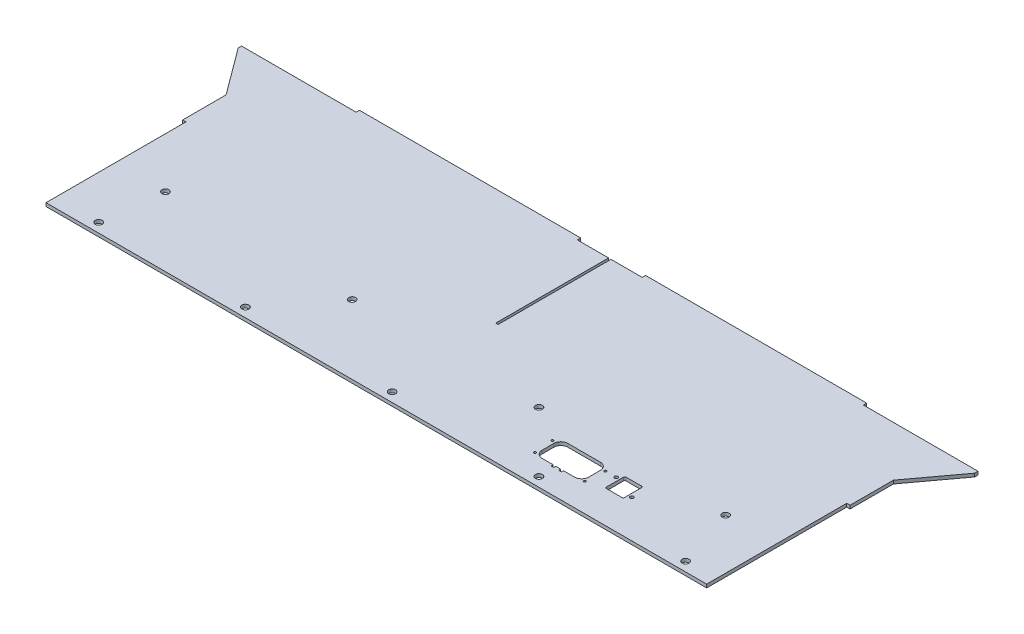
from build123d import *

# Parameters (mm, degrees)
SKETCH1_W            = 635.3556
SKETCH1_H            = 222.25
BOSS_EXTRUDE1_DEPTH  = 1.5875
BOSS_EXTRUDE3_DEPTH  = 3.175
CUT_EXTRUDE1_DEPTH   = 10
LPATTERN1_COUNT      = 5
LPATTERN1_PITCH      = 139.7
SKETCH6_W            = 3.175
SKETCH6_H            = 133.35
SKETCH6_W_2          = 2.286
SKETCH6_H_2          = 107.442
CUT_EXTRUDE2_DEPTH   = 368.782646164
M6_CLEARANCE_HOLE1_D = 6.6
LPATTERN2_COUNT      = 4
LPATTERN2_PITCH      = 177.8
SKETCH12_W           = 210.6549
SKETCH12_H           = 3.175
BOSS_EXTRUDE4_DEPTH  = 3.175
CUT_EXTRUDE3_DEPTH   = 369.754388712


with BuildPart() as part:
    # Sketch1 → Boss-Extrude1 (new, symmetric)
    with BuildSketch(Plane(origin=(0, 0, 0), x_dir=(1, 0, 0), z_dir=(0, 1, 0))):
        Rectangle(SKETCH1_W, SKETCH1_H)
    extrude(amount=BOSS_EXTRUDE1_DEPTH, both=True)

    # Sketch3 → Boss-Extrude3 (add)
    with BuildSketch(Plane(origin=(0, 1.5875, 0), x_dir=(1, 0, 0), z_dir=(0, 1, 0))):
        Polygon((-317.6778, 63.5), (-317.6778, 111.125), (-350.57842, 111.125), (-350.57842, 107.95), align=None)
    boss_extrude3 = extrude(amount=-BOSS_EXTRUDE3_DEPTH)

    # Mirror1: Boss-Extrude3 across plane
    add(boss_extrude3.mirror(Plane(origin=(0, 0, 0), x_dir=(0, 0, 1), z_dir=(1, 0, 0))))

    # Sketch4 → Cut-Extrude1 (cut)
    with BuildSketch(Plane(origin=(0, 1.5875, 0), x_dir=(1, 0, 0), z_dir=(0, 1, 0))):
        with BuildLine():
            ThreePointArc((-276.5298, -102.235), (-275.562666591, -104.569866591), (-273.2278, -105.537))
            Line((-273.2278, -105.537), (-273.2278, -102.235))
            Line((-273.2278, -102.235), (-276.5298, -102.235))
        make_face()
        with BuildLine():
            Line((-273.2278, -102.235), (-273.2278, -105.537))
            ThreePointArc((-273.2278, -105.537), (-270.892933409, -104.569866591), (-269.9258, -102.235))
            ThreePointArc((-269.9258, -102.235), (-273.2278, -98.933), (-276.5298, -102.235))
            Line((-276.5298, -102.235), (-273.2278, -102.235))
        make_face()
    cut_extrude1 = extrude(amount=-CUT_EXTRUDE1_DEPTH, mode=Mode.SUBTRACT)

    # LPattern1: Cut-Extrude1 ×5
    with Locations(*[(i * LPATTERN1_PITCH, 0, 0) for i in range(1, LPATTERN1_COUNT)]):
        add(cut_extrude1, mode=Mode.SUBTRACT)

    # Sketch6 → Cut-Extrude2 (cut, through all)
    with BuildSketch(Plane(origin=(0, 1.5875, 0), x_dir=(1, 0, 0), z_dir=(0, 1, 0))):
        with Locations((316.0903, -44.45)):
            Rectangle(SKETCH6_W, SKETCH6_H)
        with Locations((-316.0903, -44.45)):
            Rectangle(SKETCH6_W, SKETCH6_H)
        with Locations((0, 57.404)):
            Rectangle(SKETCH6_W_2, SKETCH6_H_2)
    extrude(amount=-CUT_EXTRUDE2_DEPTH, mode=Mode.SUBTRACT)

    # M6 Clearance Hole1 (through all)
    with Locations(Plane(origin=(0, 1.5875, 0), x_dir=(1, 0, 0), z_dir=(0, 1, 0))):
        with Locations((266.7, -45.2374)):
            m6_clearance_hole1 = Hole(M6_CLEARANCE_HOLE1_D / 2)

    # LPattern2: M6 Clearance Hole1 ×4
    with Locations(*[(-i * LPATTERN2_PITCH, 0, 0) for i in range(1, LPATTERN2_COUNT)]):
        add(m6_clearance_hole1, mode=Mode.SUBTRACT)

    # Sketch12 → Boss-Extrude4 (add)
    with BuildSketch(Plane(origin=(0, 0, -111.125), x_dir=(-1, 0, 0), z_dir=(0, 0, -1))):
        with Locations((-136.15035, 0)):
            Rectangle(SKETCH12_W, SKETCH12_H)
        with Locations((136.15035, 0)):
            Rectangle(SKETCH12_W, SKETCH12_H)
    extrude(amount=BOSS_EXTRUDE4_DEPTH)

    # Sketch13 → Cut-Extrude3 (cut, through all)
    with BuildSketch(Plane(origin=(0, 1.5875, 0), x_dir=(1, 0, 0), z_dir=(0, 1, 0))):
        with BuildLine():
            add(Edge.make_bspline(
                [(187.864233968, -80.025396339), (189.329368232, -80.025396339), (191.127179802, -77.455295235), (195.339233968, -79.347764363)],
                knots=[1, 1, 1, 1, 3.549888024, 3.549888024, 3.549888024, 3.549888024], degree=3))
            Line((187.864233968, -80.025396339), (194.052572976, -80.025396339))
            add(Edge.make_bspline(
                [(194.052572976, -80.025396339), (194.505115843, -79.75389316), (194.93338213, -79.530112938), (195.339233968, -79.347764363)],
                knots=[-2.795582096, -2.795582096, -2.795582096, -2.795582096, -2.549888024, -2.549888024, -2.549888024, -2.549888024], degree=3))
        make_face()
        with BuildLine():
            add(Edge.make_bspline(
                [(172.699220274, -84.2845266), (172.696730983, -84.975084699), (172.146526339, -85.612330075), (171.260043392, -85.306178116)],
                knots=[0.001799128, 0.001799128, 0.001799128, 0.001799128, 0.583907467, 0.583907467, 0.583907467, 0.583907467], degree=3, weights=[0.996408218, 0.609732375, 0.448956611, 0.514080926]))
            add(Edge.make_bspline(
                [(172.699220274, -84.2845266), (172.233117294, -84.619527082), (171.753512925, -84.960041697), (171.260043392, -85.306178116)],
                knots=[5.458035513, 5.458035513, 5.458035513, 5.458035513, 5.553043212, 5.553043212, 5.553043212, 5.553043212], degree=3))
        make_face()
        with BuildLine():
            add(Edge.make_bspline(
                [(172.699220274, -84.2845266), (172.233117294, -84.619527082), (171.753512925, -84.960041697), (171.260043392, -85.306178116)],
                knots=[5.458035513, 5.458035513, 5.458035513, 5.458035513, 5.553043212, 5.553043212, 5.553043212, 5.553043212], degree=3))
            add(Edge.make_bspline(
                [(172.699227323, -84.280615468), (172.699227323, -84.2819184), (172.699224976, -84.283222113), (172.699220274, -84.2845266)],
                knots=[0, 0, 0, 0, 0.001799128, 0.001799128, 0.001799128, 0.001799128], degree=3, weights=[1, 0.998800581, 0.997603321, 0.996408218]))
            add(Edge.make_bspline(
                [(170.529227323, -84.280615468), (170.529227323, -82.110615468), (172.699227323, -82.110615468), (172.699227323, -84.280615468)],
                knots=[0, 0, 0, 0, 1, 1, 1, 1], degree=3, weights=[1, 0.333333333, 0.333333333, 1]))
            add(Edge.make_bspline(
                [(171.260043392, -85.306178116), (170.752605364, -85.130931488), (170.529227323, -84.697127405), (170.529227323, -84.280615468)],
                knots=[0.583907467, 0.583907467, 0.583907467, 0.583907467, 1, 1, 1, 1], degree=3, weights=[0.514080926, 0.560631953, 0.722604978, 1]))
        make_face()
        with BuildLine():
            add(Edge.make_bspline(
                [(181.739234014, -66.150396507), (181.739234014, -67.66409649), (183.22321105, -68.736498813), (184.551445026, -67.194687876)],
                knots=[0, 0, 0, 0, 0.364606415, 0.364606415, 0.364606415, 0.364606415], degree=3, weights=[1, 0.513858114, 0.382217128, 0.605077042]))
            add(Edge.make_bspline(
                [(182.357862006, -64.886707866), (183.199836269, -65.706024515), (183.9264051, -66.473982103), (184.551445026, -67.194687876)],
                knots=[-3.591687883, -3.591687883, -3.591687883, -3.591687883, -3.27186619, -3.27186619, -3.27186619, -3.27186619], degree=3))
            add(Edge.make_bspline(
                [(182.357862006, -64.886707866), (181.921014319, -65.22596081), (181.739234014, -65.701474289), (181.739234014, -66.150396507)],
                knots=[0.83567377, 0.83567377, 0.83567377, 0.83567377, 1, 1, 1, 1], degree=3, weights=[0.558719959, 0.633805013, 0.78089836, 1]))
        make_face()
        with BuildLine():
            add(Edge.make_bspline(
                [(182.357862006, -64.886707866), (183.199836269, -65.706024515), (183.9264051, -66.473982103), (184.551445026, -67.194687876)],
                knots=[-3.591687883, -3.591687883, -3.591687883, -3.591687883, -3.27186619, -3.27186619, -3.27186619, -3.27186619], degree=3))
            add(Edge.make_bspline(
                [(184.551445026, -67.194687876), (184.825523373, -66.876538362), (184.939234014, -66.502865553), (184.939234014, -66.150396507), (184.939234014, -64.854128028), (183.75318586, -63.803108847), (182.357862006, -64.886707866)],
                knots=[0.364606415, 0.364606415, 0.364606415, 0.364606415, 0.5, 0.5, 0.5, 0.83567377, 0.83567377, 0.83567377, 0.83567377], degree=3, weights=[0.605077042, 0.687834234, 0.81947522, 1, 0.552434973, 0.405341626, 0.558719959]))
        make_face()
        with BuildLine():
            add(Edge.make_bspline(
                [(208.320606163, -76.414085039), (208.757453751, -76.074832094), (208.939234014, -75.599318671), (208.939234014, -75.150396507), (208.939234014, -73.636696641), (207.455257135, -72.564294316), (206.127023101, -74.106105024)],
                knots=[0.335673786, 0.335673786, 0.335673786, 0.335673786, 0.5, 0.5, 0.5, 0.8646064, 0.8646064, 0.8646064, 0.8646064], degree=3, weights=[0.55871998, 0.633805041, 0.780898381, 1, 0.513858133, 0.382217138, 0.605077016]))
            add(Edge.make_bspline(
                [(208.320606163, -76.414085039), (207.478631887, -75.594768389), (206.752063041, -74.826810798), (206.127023101, -74.106105024)],
                knots=[-3.591687913, -3.591687913, -3.591687913, -3.591687913, -3.271866223, -3.271866223, -3.271866223, -3.271866223], degree=3))
        make_face()
        with BuildLine():
            add(Edge.make_bspline(
                [(208.320606163, -76.414085039), (207.478631887, -75.594768389), (206.752063041, -74.826810798), (206.127023101, -74.106105024)],
                knots=[-3.591687913, -3.591687913, -3.591687913, -3.591687913, -3.271866223, -3.271866223, -3.271866223, -3.271866223], degree=3))
            add(Edge.make_bspline(
                [(206.127023101, -74.106105024), (205.852944683, -74.424254558), (205.739234014, -74.797927416), (205.739234014, -75.150396507)],
                knots=[0.8646064, 0.8646064, 0.8646064, 0.8646064, 1, 1, 1, 1], degree=3, weights=[0.605077016, 0.687834206, 0.8194752, 1]))
            add(Edge.make_bspline(
                [(205.739234014, -75.150396507), (205.739234014, -76.446665096), (206.925282317, -77.497684302), (208.320606163, -76.414085039)],
                knots=[0, 0, 0, 0, 0.335673786, 0.335673786, 0.335673786, 0.335673786], degree=3, weights=[1, 0.552434953, 0.405341613, 0.55871998]))
        make_face()
        with BuildLine():
            add(Edge.make_bspline(
                [(186.714233968, -78.875396339), (186.714233968, -79.019043261), (186.763644326, -79.299941363), (187.025758436, -79.71387187), (187.439688944, -79.975985981), (187.720587046, -80.025396339), (187.864233968, -80.025396339)],
                knots=[0, 0, 0, 0, 0.25, 0.5, 0.75, 1, 1, 1, 1], degree=3))
            add(Edge.make_bspline(
                [(187.864233968, -80.025396339), (189.329368232, -80.025396339), (191.127179802, -77.455295235), (195.339233968, -79.347764363)],
                knots=[1, 1, 1, 1, 3.549888024, 3.549888024, 3.549888024, 3.549888024], degree=3))
            add(Edge.make_bspline(
                [(195.339233968, -79.347764363), (199.551288134, -77.455295235), (201.349099704, -80.025396339), (202.814233968, -80.025396339)],
                knots=[-2.549888024, -2.549888024, -2.549888024, -2.549888024, 0, 0, 0, 0], degree=3))
            add(Edge.make_bspline(
                [(202.814233968, -80.025396339), (202.95788089, -80.025396339), (203.238778991, -79.975985981), (203.652709499, -79.71387187), (203.914823609, -79.299941363), (203.964233968, -79.019043261), (203.964233968, -78.875396339)],
                knots=[0, 0, 0, 0, 0.25, 0.5, 0.75, 1, 1, 1, 1], degree=3))
            add(Edge.make_bspline(
                [(203.964233968, -78.875396339), (203.964233968, -77.326116927), (201.0904451, -75.40485046), (203.658155381, -70.650396339)],
                knots=[1, 1, 1, 1, 3.696332423, 3.696332423, 3.696332423, 3.696332423], degree=3))
            add(Edge.make_bspline(
                [(203.658155381, -70.650396339), (201.0904451, -65.895942219), (203.964233968, -63.974675752), (203.964233968, -62.425396339)],
                knots=[-2.696332423, -2.696332423, -2.696332423, -2.696332423, 0, 0, 0, 0], degree=3))
            add(Edge.make_bspline(
                [(203.964233968, -62.425396339), (203.964233968, -62.281749417), (203.914823609, -62.000851316), (203.652709499, -61.586920808), (203.238778991, -61.324806697), (202.95788089, -61.275396339), (202.814233968, -61.275396339)],
                knots=[0, 0, 0, 0, 0.25, 0.5, 0.75, 1, 1, 1, 1], degree=3))
            add(Edge.make_bspline(
                [(202.814233968, -61.275396339), (201.349099704, -61.275396339), (199.551288134, -63.845497444), (195.339233968, -61.953028316)],
                knots=[1, 1, 1, 1, 3.549888024, 3.549888024, 3.549888024, 3.549888024], degree=3))
            add(Edge.make_bspline(
                [(195.339233968, -61.953028316), (191.127179802, -63.845497444), (189.329368232, -61.275396339), (187.864233968, -61.275396339)],
                knots=[-2.549888024, -2.549888024, -2.549888024, -2.549888024, 0, 0, 0, 0], degree=3))
            add(Edge.make_bspline(
                [(187.864233968, -61.275396339), (187.720587046, -61.275396339), (187.439688944, -61.324806697), (187.025758436, -61.586920808), (186.763644326, -62.000851316), (186.714233968, -62.281749417), (186.714233968, -62.425396339)],
                knots=[0, 0, 0, 0, 0.25, 0.5, 0.75, 1, 1, 1, 1], degree=3))
            add(Edge.make_bspline(
                [(186.714233968, -62.425396339), (186.714233968, -63.974675752), (189.588022835, -65.895942219), (187.020312554, -70.650396339)],
                knots=[1, 1, 1, 1, 3.696332423, 3.696332423, 3.696332423, 3.696332423], degree=3))
            add(Edge.make_bspline(
                [(187.020312554, -70.650396339), (189.588022835, -75.40485046), (186.714233968, -77.326116927), (186.714233968, -78.875396339)],
                knots=[-2.696332423, -2.696332423, -2.696332423, -2.696332423, 0, 0, 0, 0], degree=3))
        make_face()
        with BuildLine():
            add(Edge.make_bspline(
                [(194.052572976, -80.025396339), (194.505115843, -79.75389316), (194.93338213, -79.530112938), (195.339233968, -79.347764363)],
                knots=[-2.795582096, -2.795582096, -2.795582096, -2.795582096, -2.549888024, -2.549888024, -2.549888024, -2.549888024], degree=3))
            Line((194.052572976, -80.025396339), (196.625894959, -80.025396339))
            add(Edge.make_bspline(
                [(195.339233968, -79.347764363), (195.745085806, -79.530112938), (196.173352092, -79.75389316), (196.625894959, -80.025396339)],
                knots=[3.549888024, 3.549888024, 3.549888024, 3.549888024, 3.795582096, 3.795582096, 3.795582096, 3.795582096], degree=3))
        make_face()
        with BuildLine():
            Line((186.714233968, -71.187057331), (186.714233968, -78.875396339))
            add(Edge.make_bspline(
                [(187.020312554, -70.650396339), (189.588022835, -75.40485046), (186.714233968, -77.326116927), (186.714233968, -78.875396339)],
                knots=[-2.696332423, -2.696332423, -2.696332423, -2.696332423, 0, 0, 0, 0], degree=3))
            add(Edge.make_bspline(
                [(187.020312554, -70.650396339), (186.925797352, -70.825403699), (186.823909393, -71.00424978), (186.714233968, -71.187057331)],
                knots=[3.696332423, 3.696332423, 3.696332423, 3.696332423, 3.795582096, 3.795582096, 3.795582096, 3.795582096], degree=3))
        make_face()
        with BuildLine():
            add(Edge.make_bspline(
                [(195.339233968, -79.347764363), (199.551288134, -77.455295235), (201.349099704, -80.025396339), (202.814233968, -80.025396339)],
                knots=[-2.549888024, -2.549888024, -2.549888024, -2.549888024, 0, 0, 0, 0], degree=3))
            add(Edge.make_bspline(
                [(195.339233968, -79.347764363), (195.745085806, -79.530112938), (196.173352092, -79.75389316), (196.625894959, -80.025396339)],
                knots=[3.549888024, 3.549888024, 3.549888024, 3.549888024, 3.795582096, 3.795582096, 3.795582096, 3.795582096], degree=3))
            Line((196.625894959, -80.025396339), (202.814233968, -80.025396339))
        make_face()
        with BuildLine():
            Line((186.714233968, -70.113735348), (186.714233968, -71.187057331))
            add(Edge.make_bspline(
                [(187.020312554, -70.650396339), (186.925797352, -70.825403699), (186.823909393, -71.00424978), (186.714233968, -71.187057331)],
                knots=[3.696332423, 3.696332423, 3.696332423, 3.696332423, 3.795582096, 3.795582096, 3.795582096, 3.795582096], degree=3))
            add(Edge.make_bspline(
                [(186.714233968, -70.113735348), (186.823909393, -70.296542899), (186.925797352, -70.47538898), (187.020312554, -70.650396339)],
                knots=[-2.795582096, -2.795582096, -2.795582096, -2.795582096, -2.696332423, -2.696332423, -2.696332423, -2.696332423], degree=3))
        make_face()
        with BuildLine():
            add(Edge.make_bspline(
                [(186.714233968, -70.113735348), (186.823909393, -70.296542899), (186.925797352, -70.47538898), (187.020312554, -70.650396339)],
                knots=[-2.795582096, -2.795582096, -2.795582096, -2.795582096, -2.696332423, -2.696332423, -2.696332423, -2.696332423], degree=3))
            add(Edge.make_bspline(
                [(186.714233968, -62.425396339), (186.714233968, -63.974675752), (189.588022835, -65.895942219), (187.020312554, -70.650396339)],
                knots=[1, 1, 1, 1, 3.696332423, 3.696332423, 3.696332423, 3.696332423], degree=3))
            Line((186.714233968, -62.425396339), (186.714233968, -70.113735348))
        make_face()
        with BuildLine():
            add(Edge.make_bspline(
                [(203.964233968, -78.875396339), (203.964233968, -77.326116927), (201.0904451, -75.40485046), (203.658155381, -70.650396339)],
                knots=[1, 1, 1, 1, 3.696332423, 3.696332423, 3.696332423, 3.696332423], degree=3))
            Line((203.964233968, -78.875396339), (203.964233968, -71.187057331))
            add(Edge.make_bspline(
                [(203.964233968, -71.187057331), (203.854558543, -71.00424978), (203.752670584, -70.825403698), (203.658155381, -70.650396339)],
                knots=[-2.795582096, -2.795582096, -2.795582096, -2.795582096, -2.696332423, -2.696332423, -2.696332423, -2.696332423], degree=3))
        make_face()
        with BuildLine():
            Line((194.052572976, -61.275396339), (187.864233968, -61.275396339))
            add(Edge.make_bspline(
                [(195.339233968, -61.953028316), (191.127179802, -63.845497444), (189.329368232, -61.275396339), (187.864233968, -61.275396339)],
                knots=[-2.549888024, -2.549888024, -2.549888024, -2.549888024, 0, 0, 0, 0], degree=3))
            add(Edge.make_bspline(
                [(195.339233968, -61.953028316), (194.93338213, -61.770679741), (194.505115844, -61.546899518), (194.052572976, -61.275396339)],
                knots=[3.549888024, 3.549888024, 3.549888024, 3.549888024, 3.795582096, 3.795582096, 3.795582096, 3.795582096], degree=3))
        make_face()
        with BuildLine():
            add(Edge.make_bspline(
                [(203.964233968, -71.187057331), (203.854558543, -71.00424978), (203.752670584, -70.825403698), (203.658155381, -70.650396339)],
                knots=[-2.795582096, -2.795582096, -2.795582096, -2.795582096, -2.696332423, -2.696332423, -2.696332423, -2.696332423], degree=3))
            Line((203.964233968, -71.187057331), (203.964233968, -70.113735347))
            add(Edge.make_bspline(
                [(203.658155381, -70.650396339), (203.752670584, -70.47538898), (203.854558543, -70.296542898), (203.964233968, -70.113735347)],
                knots=[3.696332423, 3.696332423, 3.696332423, 3.696332423, 3.795582096, 3.795582096, 3.795582096, 3.795582096], degree=3))
        make_face()
        with BuildLine():
            add(Edge.make_bspline(
                [(203.658155381, -70.650396339), (201.0904451, -65.895942219), (203.964233968, -63.974675752), (203.964233968, -62.425396339)],
                knots=[-2.696332423, -2.696332423, -2.696332423, -2.696332423, 0, 0, 0, 0], degree=3))
            add(Edge.make_bspline(
                [(203.658155381, -70.650396339), (203.752670584, -70.47538898), (203.854558543, -70.296542898), (203.964233968, -70.113735347)],
                knots=[3.696332423, 3.696332423, 3.696332423, 3.696332423, 3.795582096, 3.795582096, 3.795582096, 3.795582096], degree=3))
            Line((203.964233968, -70.113735347), (203.964233968, -62.425396339))
        make_face()
        with BuildLine():
            Line((196.62589496, -61.275396339), (194.052572976, -61.275396339))
            add(Edge.make_bspline(
                [(195.339233968, -61.953028316), (194.93338213, -61.770679741), (194.505115844, -61.546899518), (194.052572976, -61.275396339)],
                knots=[3.549888024, 3.549888024, 3.549888024, 3.549888024, 3.795582096, 3.795582096, 3.795582096, 3.795582096], degree=3))
            add(Edge.make_bspline(
                [(196.62589496, -61.275396339), (196.173352092, -61.546899518), (195.745085806, -61.770679741), (195.339233968, -61.953028316)],
                knots=[-2.795582096, -2.795582096, -2.795582096, -2.795582096, -2.549888024, -2.549888024, -2.549888024, -2.549888024], degree=3))
        make_face()
        with BuildLine():
            add(Edge.make_bspline(
                [(196.62589496, -61.275396339), (196.173352092, -61.546899518), (195.745085806, -61.770679741), (195.339233968, -61.953028316)],
                knots=[-2.795582096, -2.795582096, -2.795582096, -2.795582096, -2.549888024, -2.549888024, -2.549888024, -2.549888024], degree=3))
            add(Edge.make_bspline(
                [(202.814233968, -61.275396339), (201.349099704, -61.275396339), (199.551288134, -63.845497444), (195.339233968, -61.953028316)],
                knots=[1, 1, 1, 1, 3.549888024, 3.549888024, 3.549888024, 3.549888024], degree=3))
            Line((202.814233968, -61.275396339), (196.62589496, -61.275396339))
        make_face()
        with BuildLine():
            Line((143.131038887, -87.780614796), (145.497415414, -87.780614796))
            Line((145.497415414, -87.780614796), (145.672392695, -85.780614626))
            Line((145.672392695, -85.780614626), (150.156061514, -85.780614626))
            Line((150.156061514, -85.780614626), (150.331038887, -87.780614796))
            Line((150.331038887, -87.780614796), (152.697415414, -87.780614796))
            Line((152.697415414, -87.780614796), (152.872392695, -85.780614626))
            Line((152.872392695, -85.780614626), (163.414227093, -85.780614626))
            ThreePointArc((163.414227093, -85.780614626), (168.151842527, -83.81823006), (170.114227093, -79.080614626))
            Line((170.114227093, -79.080614626), (170.114227093, -67.880614626))
            ThreePointArc((170.114227093, -67.880614626), (168.151842527, -63.142999192), (163.414227093, -61.180614626))
            Line((163.414227093, -61.180614626), (132.414227093, -61.180614626))
            ThreePointArc((132.414227093, -61.180614626), (127.67661166, -63.142999192), (125.714227093, -67.880614626))
            Line((125.714227093, -67.880614626), (125.714227093, -79.080614626))
            ThreePointArc((125.714227093, -79.080614626), (127.67661166, -83.81823006), (132.414227093, -85.780614626))
            Line((132.414227093, -85.780614626), (142.956061514, -85.780614626))
            Line((142.956061514, -85.780614626), (143.131038887, -87.780614796))
        make_face()
        with BuildLine():
            add(Edge.make_bspline(
                [(121.629227323, -66.180615468), (121.629227323, -64.010615468), (123.799227323, -64.010615468), (123.799227323, -66.180615468)],
                knots=[0, 0, 0, 0, 1, 1, 1, 1], degree=3, weights=[1, 0.333333333, 0.333333333, 1]))
            add(Edge.make_bspline(
                [(123.799227323, -66.180615468), (123.799227323, -68.350615468), (121.629227323, -68.350615468), (121.629227323, -66.180615468)],
                knots=[0, 0, 0, 0, 1, 1, 1, 1], degree=3, weights=[1, 0.333333333, 0.333333333, 1]))
        make_face()
        with BuildLine():
            add(Edge.make_bspline(
                [(123.129227323, -84.280615468), (123.129227323, -82.110615468), (125.299227323, -82.110615468), (125.299227323, -84.280615468)],
                knots=[0, 0, 0, 0, 1, 1, 1, 1], degree=3, weights=[1, 0.333333333, 0.333333333, 1]))
            add(Edge.make_bspline(
                [(125.299227323, -84.280615468), (125.299227323, -86.450615468), (123.129227323, -86.450615468), (123.129227323, -84.280615468)],
                knots=[0, 0, 0, 0, 1, 1, 1, 1], degree=3, weights=[1, 0.333333333, 0.333333333, 1]))
        make_face()
        with BuildLine():
            add(Edge.make_bspline(
                [(172.029227323, -66.180615468), (172.029227323, -64.010615468), (174.199227323, -64.010615468), (174.199227323, -66.180615468)],
                knots=[0, 0, 0, 0, 1, 1, 1, 1], degree=3, weights=[1, 0.333333333, 0.333333333, 1]))
            add(Edge.make_bspline(
                [(174.199227323, -66.180615468), (174.199227323, -68.350615468), (172.029227323, -68.350615468), (172.029227323, -66.180615468)],
                knots=[0, 0, 0, 0, 1, 1, 1, 1], degree=3, weights=[1, 0.333333333, 0.333333333, 1]))
        make_face()
    extrude(amount=-CUT_EXTRUDE3_DEPTH, mode=Mode.SUBTRACT)


solid = part.part
